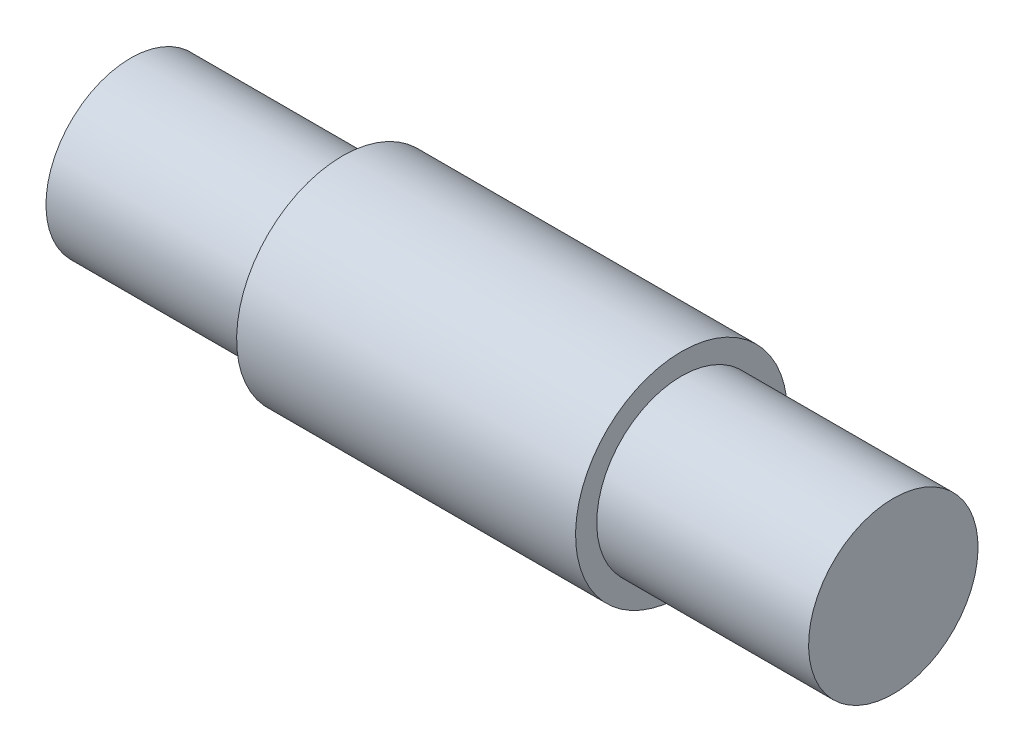
from build123d import *


with BuildPart() as part:
    # Sketch2 → Revolve1 (revolve)
    with BuildSketch(Plane.XY, mode=Mode.PRIVATE) as revolve1_sk:
        Polygon((0, 0), (4, 0), (4, 0.5), (9, 0.5), (9, 2.5), (0, 2.5), align=None)
    revolve1 = revolve(revolve1_sk.sketch.rotate(Axis((9, 2.5, 0), (-1, 0, 0)), 180), axis=Axis((9, 2.5, 0), (-1, 0, 0)))

    # Mirror1: Revolve1 across plane
    add(revolve1.mirror(Plane(origin=(0, 2.5, 0), x_dir=(0, 0, 1), z_dir=(1, 0, 0))))


solid = part.part
